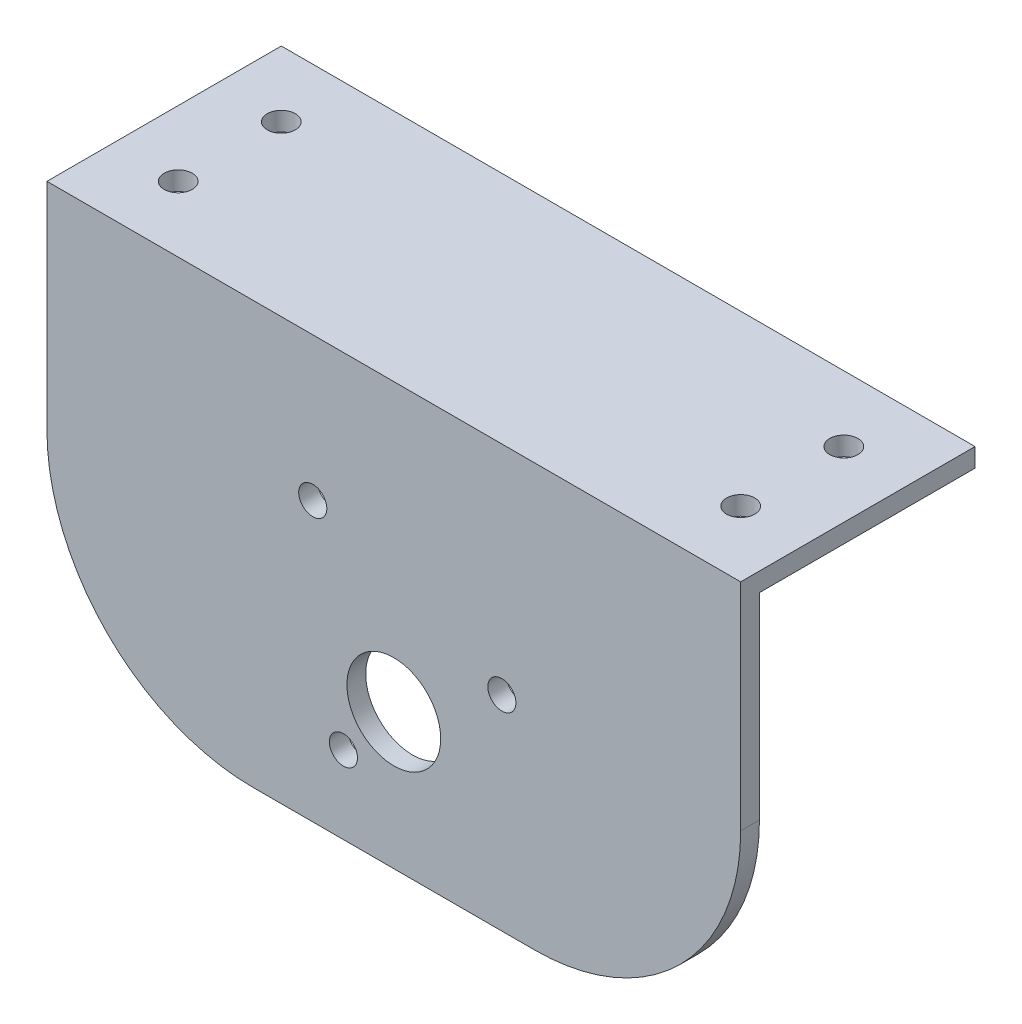
from build123d import *

# Parameters (mm, degrees)
SKETCH_1_W      = 74
SKETCH_1_H      = 25
SKETCH_1_R      = 1.5
EXTRUDE_1_DEPTH = 2
SKETCH_2_R      = 5
SKETCH_2_R_2    = 1.5
EXTRUDE_2_DEPTH = 2


with BuildPart() as part:
    # Эскиз1 → Бобышка-Вытянуть1 (new body)
    with BuildSketch(Plane(origin=(0, 0, 0), x_dir=(1, 0, 0), z_dir=(0, 1, 0))):
        with Locations((37, 12.5)):
            Rectangle(SKETCH_1_W, SKETCH_1_H)
        with Locations(Location((7, 18, 0), (0, 0, 270))):
            Circle(SKETCH_1_R, mode=Mode.SUBTRACT)
        with Locations(Location((67, 18, 0), (0, 0, 270))):
            Circle(SKETCH_1_R, mode=Mode.SUBTRACT)
        with Locations(Location((7, 7, 0), (0, 0, 270))):
            Circle(SKETCH_1_R, mode=Mode.SUBTRACT)
        with Locations(Location((67, 7, 0), (0, 0, 270))):
            Circle(SKETCH_1_R, mode=Mode.SUBTRACT)
    extrude(amount=EXTRUDE_1_DEPTH)

    # Эскиз2 → Бобышка-Вытянуть2 (add)
    with BuildSketch(Plane.XY):
        with BuildLine():
            Line((0, 2), (74, 2))
            Line((74, 2), (74, -21))
            ThreePointArc((74, -21), (67.556349186, -36.556349186), (52, -43))
            Line((52, -43), (22, -43))
            ThreePointArc((22, -43), (6.443650814, -36.556349186), (0, -21))
            Line((0, -21), (0, 2))
        make_face()
        with Locations((37, -28.5)):
            Circle(SKETCH_2_R, mode=Mode.SUBTRACT)
        with Locations((28.354168617, -13.306972233)):
            Circle(SKETCH_2_R_2, mode=Mode.SUBTRACT)
        with Locations((48.525028222, -21.173764644)):
            Circle(SKETCH_2_R_2, mode=Mode.SUBTRACT)
        with Locations((31.626756345, -34.708845272)):
            Circle(SKETCH_2_R_2, mode=Mode.SUBTRACT)
    extrude(amount=-EXTRUDE_2_DEPTH)


solid = part.part
